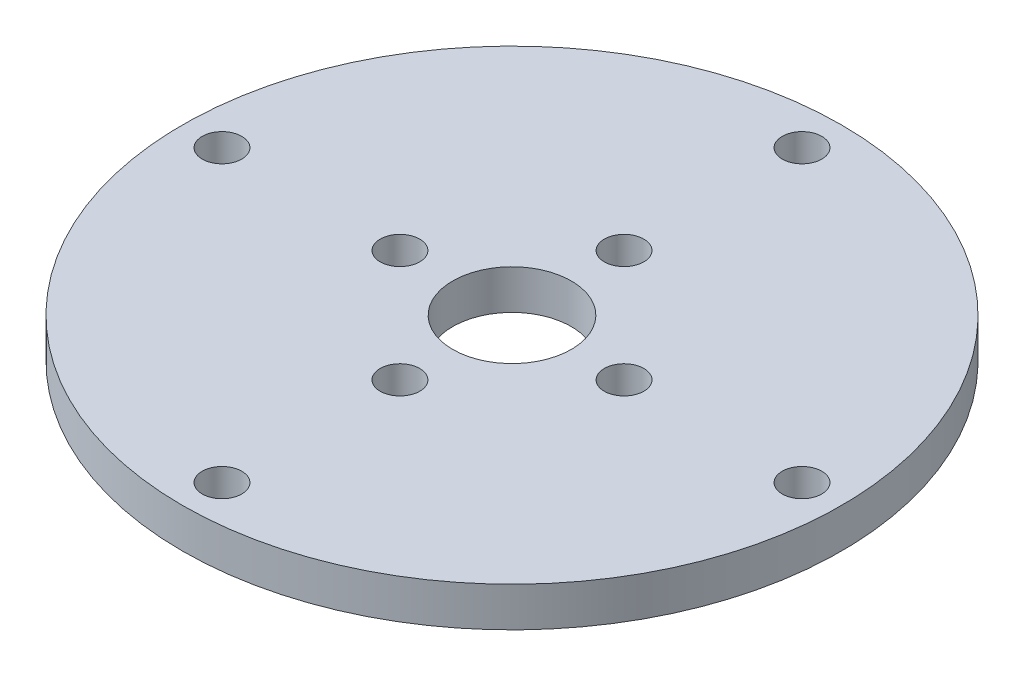
from build123d import *

# Parameters (mm, degrees)
SKETCH1_R           = 25
SKETCH1_R_2         = 4.5
BOSS_EXTRUDE1_DEPTH = 3
SKETCH2_R           = 1.5
CUT_EXTRUDE1_DEPTH  = 36.482389998
CIRPATTERN1_COUNT   = 4
SKETCH3_R           = 1.5
CUT_EXTRUDE3_DEPTH  = 36.482389998
CIRPATTERN2_COUNT   = 4


with BuildPart() as part:
    # Sketch1 → Boss-Extrude1 (new body)
    with BuildSketch(Plane(origin=(0, 0, 0), x_dir=(1, 0, 0), z_dir=(0, 1, 0))):
        with Locations(Location((0, 0, 0), (0, 0, 270))):
            Circle(SKETCH1_R)
        with Locations(Location((0, 0, 0), (0, 0, 270))):
            Circle(SKETCH1_R_2, mode=Mode.SUBTRACT)
    extrude(amount=BOSS_EXTRUDE1_DEPTH)

    # Sketch2 → Cut-Extrude1 (cut, through all)
    with BuildSketch(Plane(origin=(0, 3, 0), x_dir=(1, 0, 0), z_dir=(0, 1, 0))):
        with Locations(Location((0, 8.5, 0), (0, 0, 270))):
            Circle(SKETCH2_R)
    cut_extrude1 = extrude(amount=-CUT_EXTRUDE1_DEPTH, mode=Mode.SUBTRACT)

    # CirPattern1: Cut-Extrude1 ×4 about axis
    cirpattern1_axis = Axis((0, 0, 0), (0, 1, 0))
    for i in range(1, CIRPATTERN1_COUNT):
        add(cut_extrude1.rotate(cirpattern1_axis, i * 360 / CIRPATTERN1_COUNT), mode=Mode.SUBTRACT)

    # Sketch3 → Cut-Extrude3 (cut, through all)
    with BuildSketch(Plane(origin=(0, 3, 0), x_dir=(1, 0, 0), z_dir=(0, 1, 0))):
        with Locations(Location((0, 22, 0), (0, 0, 270))):
            Circle(SKETCH3_R)
    cut_extrude3 = extrude(amount=-CUT_EXTRUDE3_DEPTH, mode=Mode.SUBTRACT)

    # CirPattern2: Cut-Extrude3 ×4 about axis
    cirpattern2_axis = Axis((0, 0, 0), (0, 1, 0))
    for i in range(1, CIRPATTERN2_COUNT):
        add(cut_extrude3.rotate(cirpattern2_axis, i * 360 / CIRPATTERN2_COUNT), mode=Mode.SUBTRACT)


solid = part.part
